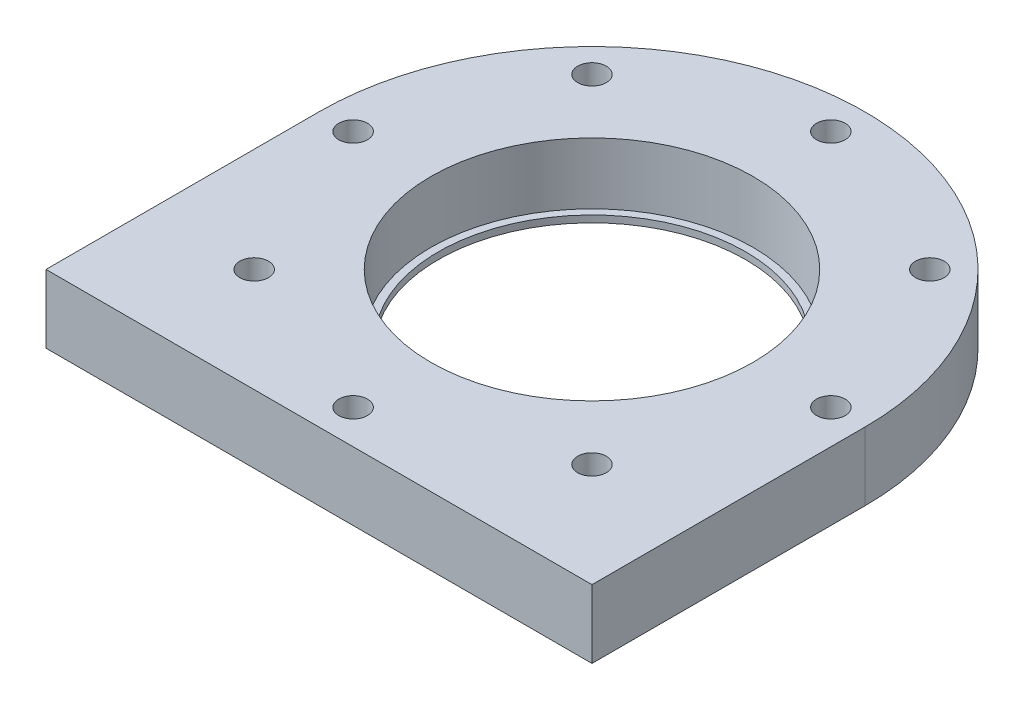
from build123d import *

# Parameters (mm, degrees)
SKETCH_1_R          = 22.5
EXTRUDE_1_DEPTH     = 10
SKETCH_2_R          = 2.1
CUT_EXTRUDE_1_DEPTH = 58.445626465
SKETCH_5_R          = 23.6
CUT_EXTRUDE_2_DEPTH = 9


with BuildPart() as part:
    # 草图1 → 凸台-拉伸1 (new body)
    with BuildSketch(Plane(origin=(0, 0, 0), x_dir=(1, 0, 0), z_dir=(0, 1, 0))):
        with BuildLine():
            Line((-40, 0), (-40, -40))
            Line((-40, -40), (40, -40))
            Line((40, -40), (40, 0))
            ThreePointArc((40, 0), (0, 40), (-40, 0))
        make_face()
        with Locations(Location((0, 0, 0), (0, 0, 270))):
            Circle(SKETCH_1_R, mode=Mode.SUBTRACT)
    extrude(amount=EXTRUDE_1_DEPTH)

    # 草图2 → 切除-拉伸1 (cut, through all)
    with BuildSketch(Plane(origin=(0, 10, 0), x_dir=(1, 0, 0), z_dir=(0, 1, 0))):
        with Locations(Location((0, 35, 0), (0, 0, 270))):
            Circle(SKETCH_2_R)
        with Locations(Location((24.748737342, 24.748737342, 0), (0, 0, 270))):
            Circle(SKETCH_2_R)
        with Locations(Location((35, 0, 0), (0, 0, 270))):
            Circle(SKETCH_2_R)
        with Locations(Location((24.748737342, -24.748737342, 0), (0, 0, 270))):
            Circle(SKETCH_2_R)
        with Locations(Location((0, -35, 0), (0, 0, 270))):
            Circle(SKETCH_2_R)
        with Locations(Location((-24.748737342, -24.748737342, 0), (0, 0, 270))):
            Circle(SKETCH_2_R)
        with Locations(Location((-35, 0, 0), (0, 0, 270))):
            Circle(SKETCH_2_R)
        with Locations(Location((-24.748737342, 24.748737342, 0), (0, 0, 270))):
            Circle(SKETCH_2_R)
    extrude(amount=-CUT_EXTRUDE_1_DEPTH, mode=Mode.SUBTRACT)

    # 草图5 → 切除-拉伸2 (cut)
    with BuildSketch(Plane(origin=(0, 10, 0), x_dir=(1, 0, 0), z_dir=(0, 1, 0))):
        with Locations(Location((0, 0, 0), (0, 0, 270))):
            Circle(SKETCH_5_R)
    extrude(amount=-CUT_EXTRUDE_2_DEPTH, mode=Mode.SUBTRACT)


solid = part.part
